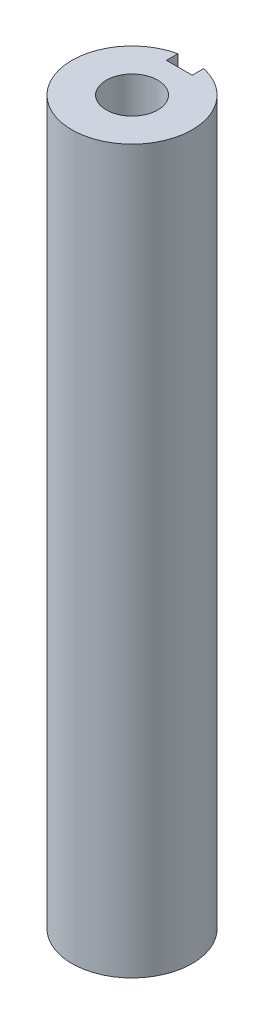
from build123d import *

# Parameters (mm, degrees)
SKETCH1_R   = 4.7625
SHAFT_DEPTH = 133.35


with BuildPart() as part:
    # Sketch1 → Shaft (new body)
    with BuildSketch(Plane(origin=(0, 0, 0), x_dir=(1, 0, 0), z_dir=(0, 1, 0))):
        with BuildLine():
            Line((-2.38125, 10.854368), (-2.38125, 8.73125))
            Line((-2.38125, 8.73125), (2.38125, 8.73125))
            Line((2.38125, 8.73125), (2.38125, 10.854368))
            ThreePointArc((2.38125, 10.854368), (0, -11.1125), (-2.38125, 10.854368))
        make_face()
        with Locations(Location((0, 0, 0), (0, 0, 270))):
            Circle(SKETCH1_R, mode=Mode.SUBTRACT)
    extrude(amount=SHAFT_DEPTH)


solid = part.part
